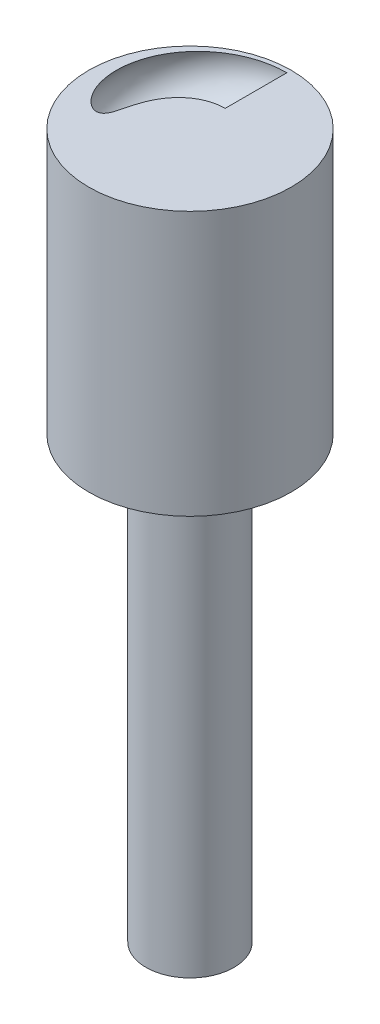
from build123d import *

# Parameters (mm, degrees)
SKETCH2_R           = 17.5
BOSS_EXTRUDE2_DEPTH = 30
SKETCH3_R           = 11.5
CUT_EXTRUDE1_DEPTH  = 30
CUT_EXTRUDE1_DRAFT  = -5
SKETCH4_R           = 15
SKETCH4_R_2         = 12.5
CUT_EXTRUDE2_DEPTH  = 5
SKETCH8_R           = 11.5
BOSS_EXTRUDE3_DEPTH = 30
SWEEP3_PITCH        = 10.666666667
SWEEP3_HEIGHT       = 24
SWEEP3_RADIUS       = 7.5
SKETCH10_R          = 3.5
SKETCH11_R          = 5
BOSS_EXTRUDE4_DEPTH = 50
SKETCH16_R          = 3.036795298
CUT_EXTRUDE7_DEPTH  = 6


with BuildPart() as part:
    # Sketch2 → Boss-Extrude2 (new body)
    with BuildSketch(Plane(origin=(0, 0, 0), x_dir=(1, 0, 0), z_dir=(0, 1, 0))):
        with Locations(Location((0, 0, 0), (0, 0, 270))):
            Circle(SKETCH2_R)
    extrude(amount=BOSS_EXTRUDE2_DEPTH)


with BuildPart() as cut_extrude1_tool:
    # Sketch3 → Cut-Extrude1 (with draft: the straight prism first)
    with BuildSketch(Plane.XZ):
        Circle(SKETCH3_R)
    extrude(amount=-CUT_EXTRUDE1_DEPTH)
    # Cut-Extrude1: the draft: its side faces are tilted about the plane it starts from
    cut_extrude1_sides = [cut_extrude1_tool.faces().sort_by_distance(p)[0] for p in [
        (-11.5, 15, 0),
    ]]
    draft(cut_extrude1_sides, Plane.XZ, CUT_EXTRUDE1_DRAFT)


with BuildPart() as part_1:
    add(part.part)

    # Cut-Extrude1: cut by cut_extrude1_tool
    add(cut_extrude1_tool.part, mode=Mode.SUBTRACT)

    # Sketch4 → Cut-Extrude2 (cut)
    with BuildSketch(Plane.XZ):
        with Locations(Location((0, 0.439504446, 0), (0, 0, 270))):
            Circle(SKETCH4_R)
        with Locations(Location((0, 0.439504446, 0), (0, 0, 270))):
            Circle(SKETCH4_R_2, mode=Mode.SUBTRACT)
    extrude(amount=-CUT_EXTRUDE2_DEPTH, mode=Mode.SUBTRACT)


with BuildPart() as body_2:
    # Sketch8 → Boss-Extrude3 (new body)
    with BuildSketch(Plane.XZ):
        with Locations(Location((0, 0, 0), (0, 0, 270))):
            Circle(SKETCH8_R)
    extrude(amount=BOSS_EXTRUDE3_DEPTH)


with BuildPart() as body_3:
    # Sweep3: sweep along a helix
    with BuildLine() as sweep3_path:
        Helix(SWEEP3_PITCH, SWEEP3_HEIGHT, SWEEP3_RADIUS, center=(0, 0, 0), direction=(0, -1, 0), lefthand=True)
    # Sketch10 → Sweep3 (sweep)
    with BuildSketch(Plane(origin=(0, 0, 0), x_dir=(0, 0, -1), z_dir=(1, 0, 0))):
        with Locations((-7.5, -16)):
            Circle(SKETCH10_R)
    sweep(path=sweep3_path.line, is_frenet=True)


with BuildPart() as body_2_1:
    add(body_2.part)

    # Combine1: cut body 3
    add(body_3.part, mode=Mode.SUBTRACT)

    # Sketch11 → Boss-Extrude4 (add)
    with BuildSketch(Plane.XZ.offset(30)):
        with Locations(Location((0, 0, 0), (0, 0, 270))):
            Circle(SKETCH11_R)
    extrude(amount=BOSS_EXTRUDE4_DEPTH)

    # Sketch16 → Cut-Extrude7 (cut)
    with BuildSketch(Plane.XZ.offset(30)):
        with Locations(Location((-7.743073418, -2.269070065, 0), (0, 0, 270))):
            Circle(SKETCH16_R)
    extrude(amount=-CUT_EXTRUDE7_DEPTH, mode=Mode.SUBTRACT)


solid = body_2_1.part
